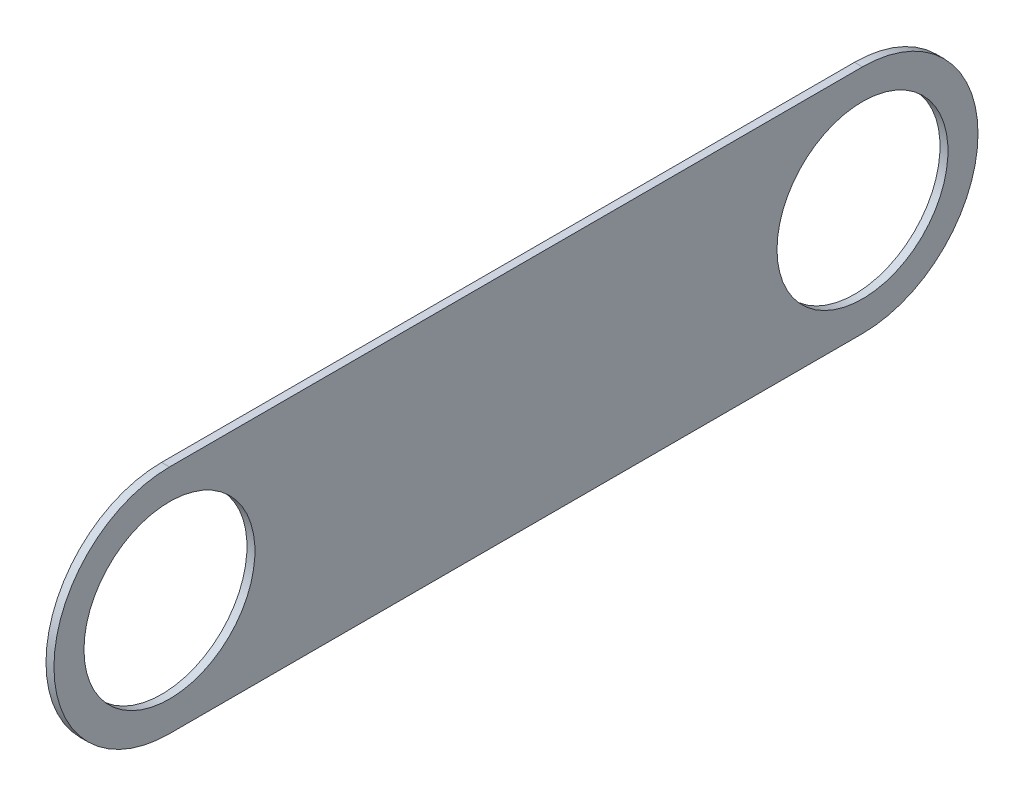
from build123d import *

# Parameters (mm, degrees)
BOSS_EXTRUDE1_DEPTH = 0.87376
SKETCH2_R           = 9.398
CUT_EXTRUDE1_DEPTH  = 0.87376


with BuildPart() as part:
    # Sketch1 → Boss-Extrude1 (new body)
    with BuildSketch(Plane.YZ):
        with BuildLine():
            Line((0, 0), (0, 76.2))
            ThreePointArc((0, 76.2), (12.7, 88.9), (25.4, 76.2))
            Line((25.4, 76.2), (25.4, 0))
            ThreePointArc((25.4, 0), (12.7, -12.7), (0, 0))
        make_face()
    extrude(amount=BOSS_EXTRUDE1_DEPTH)

    # Sketch2 → Cut-Extrude1 (cut)
    with BuildSketch(Plane.YZ):
        with Locations(Location((12.7, 76.2, 0), (0, 0, 90))):
            Circle(SKETCH2_R)
        with Locations(Location((12.7, 0, 0), (0, 0, 90))):
            Circle(SKETCH2_R)
    extrude(amount=CUT_EXTRUDE1_DEPTH, mode=Mode.SUBTRACT)


solid = part.part
